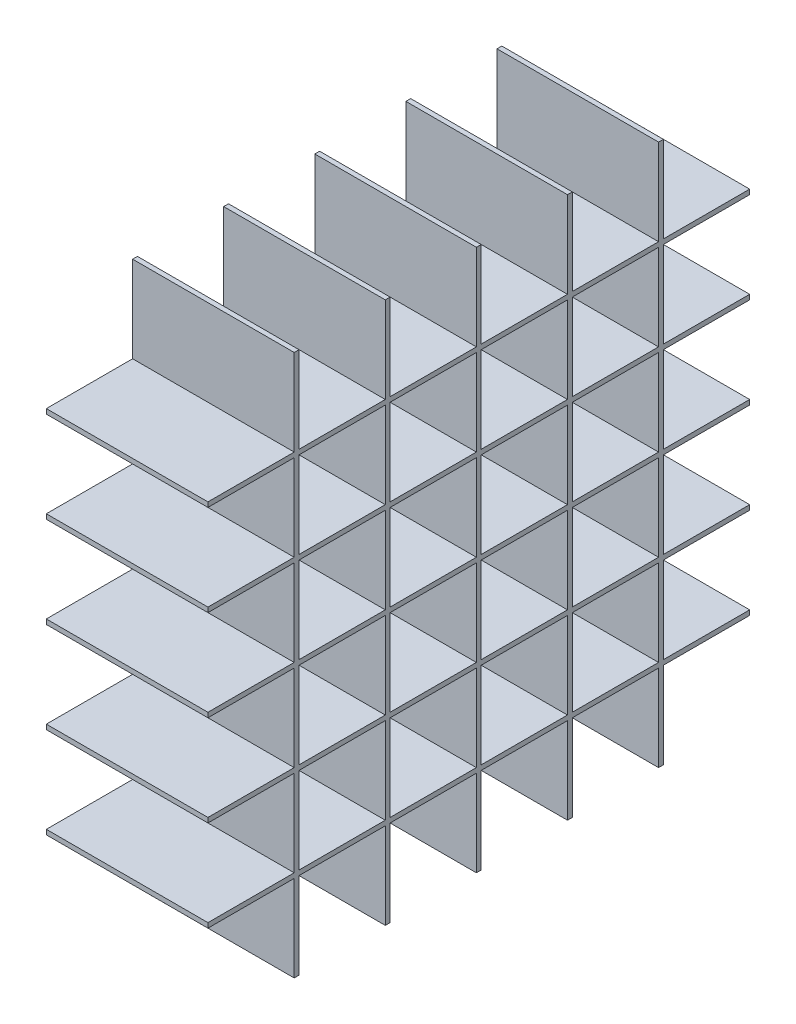
from build123d import *

# Parameters (mm, degrees)
SKETCH1_W               = 228.6
SKETCH1_H               = 228.6
BOSS_EXTRUDE1_DEPTH     = 67
SKETCH2_W               = 35.766
SKETCH2_H               = 35.766
CUT_EXTRUDE1_DEPTH      = 76.2
CUT_EXTRUDE3_DEPTH      = 4
CUT_EXTRUDE3_DEPTH_BACK = 4
SKETCH4_W               = 67
SKETCH4_H               = 35.766
CUT_EXTRUDE4_DEPTH      = 4
CUT_EXTRUDE4_DEPTH_BACK = 4
SKETCH5_W               = 67
SKETCH5_H               = 37.77
SKETCH5_H_2             = 35.766
CUT_EXTRUDE5_DEPTH      = 4
CUT_EXTRUDE5_DEPTH_BACK = 4
SKETCH6_W               = 67
SKETCH6_H               = 35.766
SKETCH6_H_2             = 37.77
CUT_EXTRUDE6_DEPTH      = 4
CUT_EXTRUDE6_DEPTH_BACK = 4
SKETCH9_W               = 67
SKETCH9_H               = 37.766
SKETCH9_H_2             = 35.766
SKETCH9_H_3             = 37.77
SKETCH10_W              = 67
SKETCH10_H              = 2
CUT_EXTRUDE7_DEPTH      = 233.316821509
SKETCH11_W              = 67
SKETCH11_H              = 2
CUT_EXTRUDE8_DEPTH      = 231.673489808


with BuildPart() as part:
    # Sketch1 → Boss-Extrude1 (new body)
    with BuildSketch(Plane(origin=(0, 0, 0), x_dir=(0, 0, -1), z_dir=(1, 0, 0))):
        Rectangle(SKETCH1_W, SKETCH1_H)
    extrude(amount=BOSS_EXTRUDE1_DEPTH)

    # Sketch2 → Cut-Extrude1 (cut)
    with BuildSketch(Plane(origin=(67, 0, 0), x_dir=(0, 0, -1), z_dir=(1, 0, 0))):
        with Locations((-94.417, 94.417)):
            Rectangle(SKETCH2_W, SKETCH2_H)
        with Locations((-56.651, 94.417)):
            Rectangle(SKETCH2_W, SKETCH2_H)
        with Locations((18.881, 94.417)):
            Rectangle(SKETCH2_W, SKETCH2_H)
        with Locations((-18.885, 94.417)):
            Rectangle(SKETCH2_W, SKETCH2_H)
        with Locations((56.647, 94.417)):
            Rectangle(SKETCH2_W, SKETCH2_H)
        with Locations((94.413, 94.417)):
            Rectangle(SKETCH2_W, SKETCH2_H)
        with Locations((56.647, 56.651)):
            Rectangle(SKETCH2_W, SKETCH2_H)
        with Locations((94.413, 56.651)):
            Rectangle(SKETCH2_W, SKETCH2_H)
        with Locations((18.881, 56.651)):
            Rectangle(SKETCH2_W, SKETCH2_H)
        with Locations((-18.885, 56.651)):
            Rectangle(SKETCH2_W, SKETCH2_H)
        with Locations((-56.651, 56.651)):
            Rectangle(SKETCH2_W, SKETCH2_H)
        with Locations((-94.417, 56.651)):
            Rectangle(SKETCH2_W, SKETCH2_H)
        with Locations((-94.417, 18.885)):
            Rectangle(SKETCH2_W, SKETCH2_H)
        with Locations((-56.651, 18.885)):
            Rectangle(SKETCH2_W, SKETCH2_H)
        with Locations((-18.885, 18.885)):
            Rectangle(SKETCH2_W, SKETCH2_H)
        with Locations((18.881, 18.885)):
            Rectangle(SKETCH2_W, SKETCH2_H)
        with Locations((56.647, 18.885)):
            Rectangle(SKETCH2_W, SKETCH2_H)
        with Locations((94.413, 18.885)):
            Rectangle(SKETCH2_W, SKETCH2_H)
        with Locations((94.413, -18.881)):
            Rectangle(SKETCH2_W, SKETCH2_H)
        with Locations((56.647, -18.881)):
            Rectangle(SKETCH2_W, SKETCH2_H)
        with Locations((18.881, -18.881)):
            Rectangle(SKETCH2_W, SKETCH2_H)
        with Locations((-18.885, -18.881)):
            Rectangle(SKETCH2_W, SKETCH2_H)
        with Locations((-56.651, -18.881)):
            Rectangle(SKETCH2_W, SKETCH2_H)
        with Locations((-94.417, -18.881)):
            Rectangle(SKETCH2_W, SKETCH2_H)
        with Locations((56.647, -56.647)):
            Rectangle(SKETCH2_W, SKETCH2_H)
        with Locations((94.413, -56.647)):
            Rectangle(SKETCH2_W, SKETCH2_H)
        with Locations((94.413, -94.413)):
            Rectangle(SKETCH2_W, SKETCH2_H)
        with Locations((56.647, -94.413)):
            Rectangle(SKETCH2_W, SKETCH2_H)
        with Locations((18.881, -94.413)):
            Rectangle(SKETCH2_W, SKETCH2_H)
        with Locations((18.881, -56.647)):
            Rectangle(SKETCH2_W, SKETCH2_H)
        with Locations((-18.885, -56.647)):
            Rectangle(SKETCH2_W, SKETCH2_H)
        with Locations((-18.885, -94.413)):
            Rectangle(SKETCH2_W, SKETCH2_H)
        with Locations((-56.651, -94.413)):
            Rectangle(SKETCH2_W, SKETCH2_H)
        with Locations((-56.651, -56.647)):
            Rectangle(SKETCH2_W, SKETCH2_H)
        with Locations((-94.417, -94.413)):
            Rectangle(SKETCH2_W, SKETCH2_H)
        with Locations((-94.417, -56.647)):
            Rectangle(SKETCH2_W, SKETCH2_H)
    extrude(amount=-CUT_EXTRUDE1_DEPTH, mode=Mode.SUBTRACT)

    # Sketch4 → Cut-Extrude3 (cut, two sides: drawn at the far end of the back side and taken through both)
    with BuildSketch(Plane(origin=(0, -114.3, 0), x_dir=(1, 0, 0), z_dir=(0, 1, 0)).offset(-CUT_EXTRUDE3_DEPTH_BACK)):
        with Locations((33.5, -94.417)):
            Rectangle(SKETCH4_W, SKETCH4_H)
        with Locations((33.5, -56.651)):
            Rectangle(SKETCH4_W, SKETCH4_H)
        with Locations((33.5, -18.885)):
            Rectangle(SKETCH4_W, SKETCH4_H)
        with Locations((33.5, 18.881)):
            Rectangle(SKETCH4_W, SKETCH4_H)
        with Locations((33.5, 56.647)):
            Rectangle(SKETCH4_W, SKETCH4_H)
        with Locations((33.5, 94.413)):
            Rectangle(SKETCH4_W, SKETCH4_H)
    extrude(amount=CUT_EXTRUDE3_DEPTH + CUT_EXTRUDE3_DEPTH_BACK, mode=Mode.SUBTRACT)

    # Sketch5 → Cut-Extrude4 (cut, two sides: drawn at the far end of the back side and taken through both)
    with BuildSketch(Plane.XY.offset(114.3).offset(-CUT_EXTRUDE4_DEPTH_BACK)):
        with Locations((33.5, -95.415)):
            Rectangle(SKETCH5_W, SKETCH5_H)
        with Locations((33.5, -56.647)):
            Rectangle(SKETCH5_W, SKETCH5_H_2)
        with Locations((33.5, -18.881)):
            Rectangle(SKETCH5_W, SKETCH5_H_2)
        with Locations((33.5, 18.885)):
            Rectangle(SKETCH5_W, SKETCH5_H_2)
        with Locations((33.5, 56.651)):
            Rectangle(SKETCH5_W, SKETCH5_H_2)
        with Locations((33.5, 94.417)):
            Rectangle(SKETCH5_W, SKETCH5_H_2)
    extrude(amount=CUT_EXTRUDE4_DEPTH + CUT_EXTRUDE4_DEPTH_BACK, mode=Mode.SUBTRACT)

    # Sketch6 → Cut-Extrude5 (cut, two sides: drawn at the far end of the back side and taken through both)
    with BuildSketch(Plane.XY.offset(-114.3).offset(-CUT_EXTRUDE5_DEPTH_BACK)):
        with Locations((33.5, 94.417)):
            Rectangle(SKETCH6_W, SKETCH6_H)
        with Locations((33.5, 56.651)):
            Rectangle(SKETCH6_W, SKETCH6_H)
        with Locations((33.5, 18.885)):
            Rectangle(SKETCH6_W, SKETCH6_H)
        with Locations((33.5, -18.881)):
            Rectangle(SKETCH6_W, SKETCH6_H)
        with Locations((33.5, -56.647)):
            Rectangle(SKETCH6_W, SKETCH6_H)
        with Locations((33.5, -95.415)):
            Rectangle(SKETCH6_W, SKETCH6_H_2)
    extrude(amount=CUT_EXTRUDE5_DEPTH + CUT_EXTRUDE5_DEPTH_BACK, mode=Mode.SUBTRACT)

    # Sketch9 → Cut-Extrude6 (cut, two sides: drawn at the far end of the back side and taken through both)
    with BuildSketch(Plane(origin=(0, 114.3, 0), x_dir=(1, 0, 0), z_dir=(0, 1, 0)).offset(-CUT_EXTRUDE6_DEPTH_BACK)):
        with Locations((33.5, -95.417)):
            Rectangle(SKETCH9_W, SKETCH9_H)
        with Locations((33.5, -56.651)):
            Rectangle(SKETCH9_W, SKETCH9_H_2)
        with Locations((33.5, -18.885)):
            Rectangle(SKETCH9_W, SKETCH9_H_2)
        with Locations((33.5, 18.881)):
            Rectangle(SKETCH9_W, SKETCH9_H_2)
        with Locations((33.5, 56.647)):
            Rectangle(SKETCH9_W, SKETCH9_H_2)
        with Locations((33.5, 95.415)):
            Rectangle(SKETCH9_W, SKETCH9_H_3)
    extrude(amount=CUT_EXTRUDE6_DEPTH + CUT_EXTRUDE6_DEPTH_BACK, mode=Mode.SUBTRACT)

    # Sketch10 → Cut-Extrude7 (cut, through all)
    with BuildSketch(Plane.XY.offset(76.534)):
        with Locations((33.5, -113.3)):
            Rectangle(SKETCH10_W, SKETCH10_H)
        with Locations((33.5, 113.3)):
            Rectangle(SKETCH10_W, SKETCH10_H)
    extrude(amount=-CUT_EXTRUDE7_DEPTH, mode=Mode.SUBTRACT)

    # Sketch11 → Cut-Extrude8 (cut, through all)
    with BuildSketch(Plane(origin=(0, -76.53, 0), x_dir=(-1, 0, 0), z_dir=(0, -1, 0))):
        with Locations((-33.5, 113.3)):
            Rectangle(SKETCH11_W, SKETCH11_H)
        with Locations((-33.5, -113.3)):
            Rectangle(SKETCH11_W, SKETCH11_H)
    extrude(amount=-CUT_EXTRUDE8_DEPTH, mode=Mode.SUBTRACT)


solid = part.part
